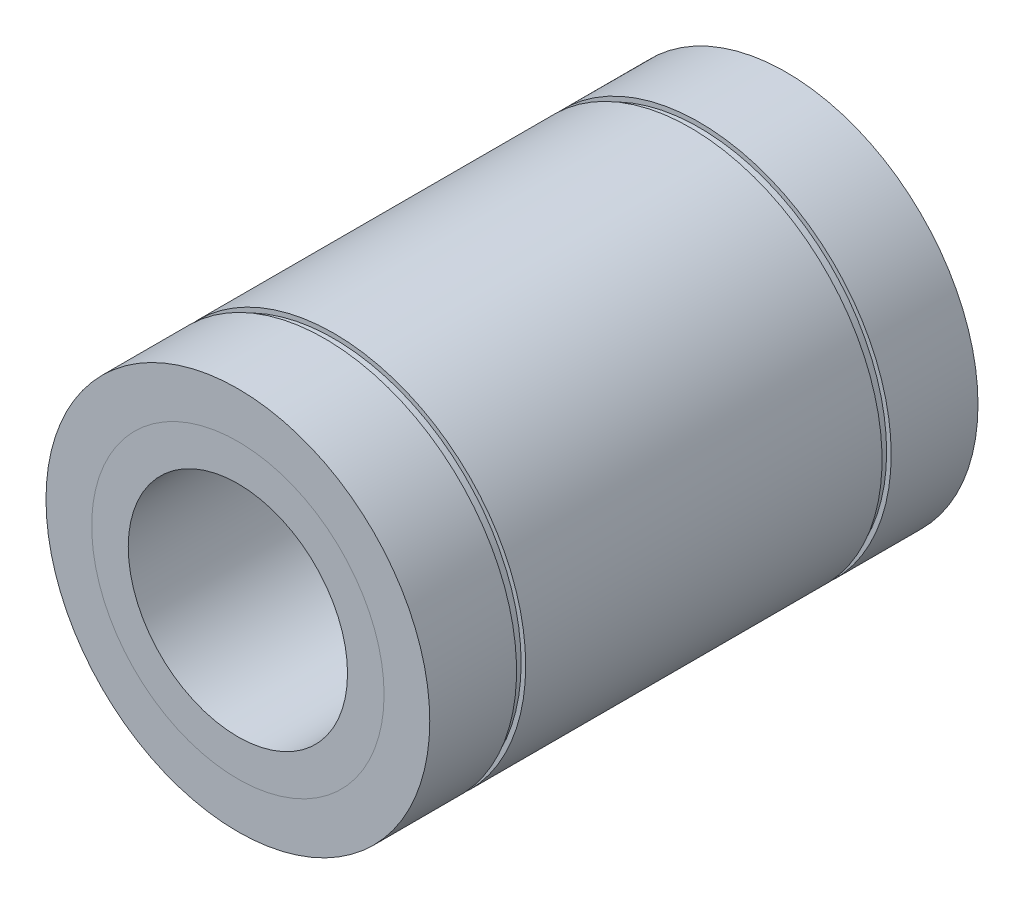
from build123d import *

# Parameters (mm, degrees)
SKETCH1_R           = 10.5
SKETCH1_R_2         = 8
BOSS_EXTRUDE1_DEPTH = 15
SKETCH2_R           = 8
SKETCH2_R_2         = 6
BOSS_EXTRUDE2_DEPTH = 15
SKETCH3_W           = 0.5
SKETCH3_H           = 0.5


with BuildPart() as part:
    # Sketch1 → Boss-Extrude1 (new, symmetric)
    with BuildSketch(Plane.XY):
        Circle(SKETCH1_R)
        Circle(SKETCH1_R_2, mode=Mode.SUBTRACT)
    extrude(amount=BOSS_EXTRUDE1_DEPTH, both=True)

    # Sketch3 → Cut-Revolve1 (revolve, cut)
    with BuildSketch(Plane(origin=(0, 0, 0), x_dir=(1, 0, 0), z_dir=(0, 1, 0)), mode=Mode.PRIVATE) as cut_revolve1_sk:
        with Locations((-10.5, -10)):
            Rectangle(SKETCH3_W, SKETCH3_H)
        with Locations((-10.5, 10)):
            Rectangle(SKETCH3_W, SKETCH3_H)
    revolve(cut_revolve1_sk.sketch.rotate(Axis((0, 0, 15), (0, 0, -1)), 180), axis=Axis((0, 0, 15), (0, 0, -1)), mode=Mode.SUBTRACT)


with BuildPart() as body_2:
    # Sketch2 → Boss-Extrude2 (new, symmetric)
    with BuildSketch(Plane.XY):
        Circle(SKETCH2_R)
        Circle(SKETCH2_R_2, mode=Mode.SUBTRACT)
    extrude(amount=BOSS_EXTRUDE2_DEPTH, both=True)


solid = Compound([part.part, body_2.part])
